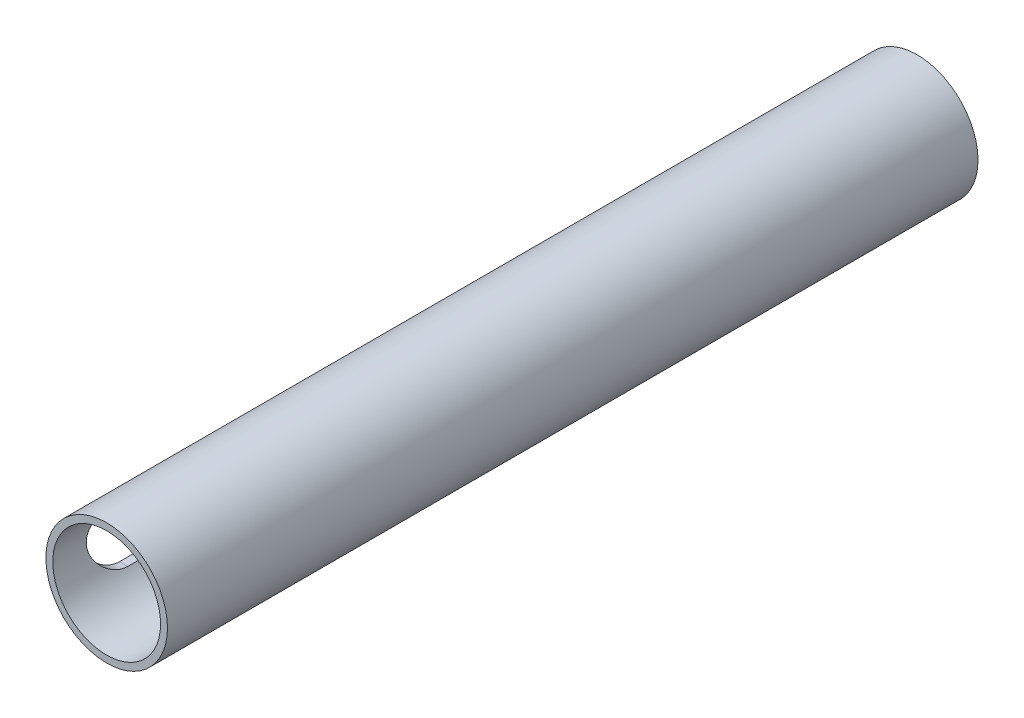
from build123d import *

# Parameters (mm, degrees)
SKETCH1_R           = 11.43
BOSS_EXTRUDE1_DEPTH = 152.4
SKETCH2_R           = 10.133203601
CUT_EXTRUDE1_DEPTH  = 149.86
CUT_EXTRUDE2_DEPTH  = 12.7


with BuildPart() as part:
    # Sketch1 → Boss-Extrude1 (new body)
    with BuildSketch(Plane.XY):
        with Locations(Location((0, 0, 0), (0, 0, 180))):
            Circle(SKETCH1_R)
    extrude(amount=BOSS_EXTRUDE1_DEPTH)

    # Sketch2 → Cut-Extrude1 (cut)
    with BuildSketch(Plane.XY.offset(152.4)):
        Circle(SKETCH2_R)
    extrude(amount=-CUT_EXTRUDE1_DEPTH, mode=Mode.SUBTRACT)

    # Sketch3 → Cut-Extrude2 (cut)
    with BuildSketch(Plane(origin=(0, 0, 0), x_dir=(0, 0, -1), z_dir=(1, 0, 0))):
        with BuildLine():
            Line((-10.671040116, -5.903350135), (-140.211040116, -5.903350135))
            ThreePointArc((-140.211040116, -5.903350135), (-146.114390251, 0), (-140.211040116, 5.903350135))
            Line((-140.211040116, 5.903350135), (-10.671040116, 5.903350135))
            ThreePointArc((-10.671040116, 5.903350135), (-4.767689981, 0), (-10.671040116, -5.903350135))
        make_face()
    extrude(amount=-CUT_EXTRUDE2_DEPTH, mode=Mode.SUBTRACT)


solid = part.part
